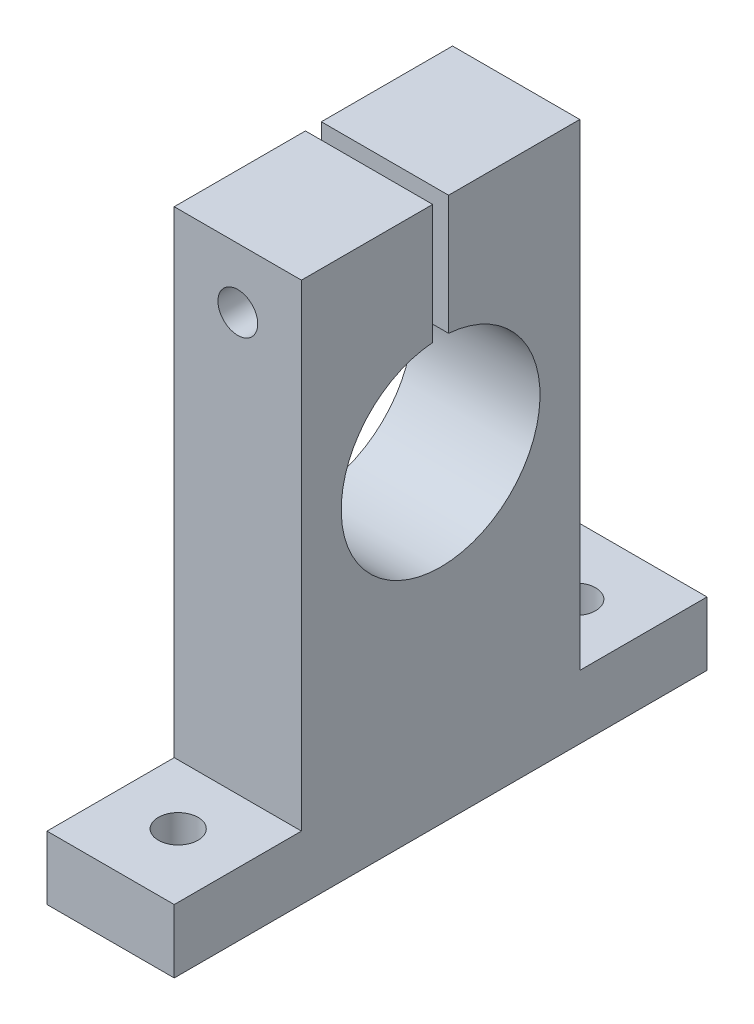
from build123d import *

# Parameters (mm, degrees)
BOSS_EXTRUDE1_DEPTH = 16
SKETCH2_R           = 2.5
CUT_EXTRUDE1_DEPTH  = 71.556714776
SKETCH3_R           = 2.5
CUT_EXTRUDE2_DEPTH  = 68.061538903


with BuildPart() as part:
    # Sketch1 → Boss-Extrude1 (new body)
    with BuildSketch(Plane(origin=(0, 0, 0), x_dir=(0, 0, -1), z_dir=(1, 0, 0))):
        with BuildLine():
            Line((17.5, -32.5), (33.5, -32.5))
            Line((33.5, -32.5), (33.5, -40.5))
            Line((33.5, -40.5), (-33.5, -40.5))
            Line((-33.5, -40.5), (-33.5, -32.5))
            Line((-33.5, -32.5), (-17.5, -32.5))
            Line((-17.5, -32.5), (-17.5, 27.5))
            Line((-17.5, 27.5), (-1, 27.5))
            Line((-1, 27.5), (-1, 12.459935794))
            ThreePointArc((-1, 12.459935794), (0, -12.5), (1, 12.459935794))
            Line((1, 12.459935794), (1, 27.5))
            Line((1, 27.5), (17.5, 27.5))
            Line((17.5, 27.5), (17.5, -32.5))
        make_face()
    extrude(amount=BOSS_EXTRUDE1_DEPTH)

    # Sketch2 → Cut-Extrude1 (cut, through all)
    with BuildSketch(Plane(origin=(0, -32.5, 0), x_dir=(1, 0, 0), z_dir=(0, 1, 0))):
        with Locations((8, -25)):
            Circle(SKETCH2_R)
        with Locations((8, 25)):
            Circle(SKETCH2_R)
    extrude(amount=-CUT_EXTRUDE1_DEPTH, mode=Mode.SUBTRACT)

    # Sketch3 → Cut-Extrude2 (cut, through all)
    with BuildSketch(Plane(origin=(0, 0, -17.5), x_dir=(-1, 0, 0), z_dir=(0, 0, -1))):
        with Locations((-8, 19.979967897)):
            Circle(SKETCH3_R)
    extrude(amount=-CUT_EXTRUDE2_DEPTH, mode=Mode.SUBTRACT)


solid = part.part
